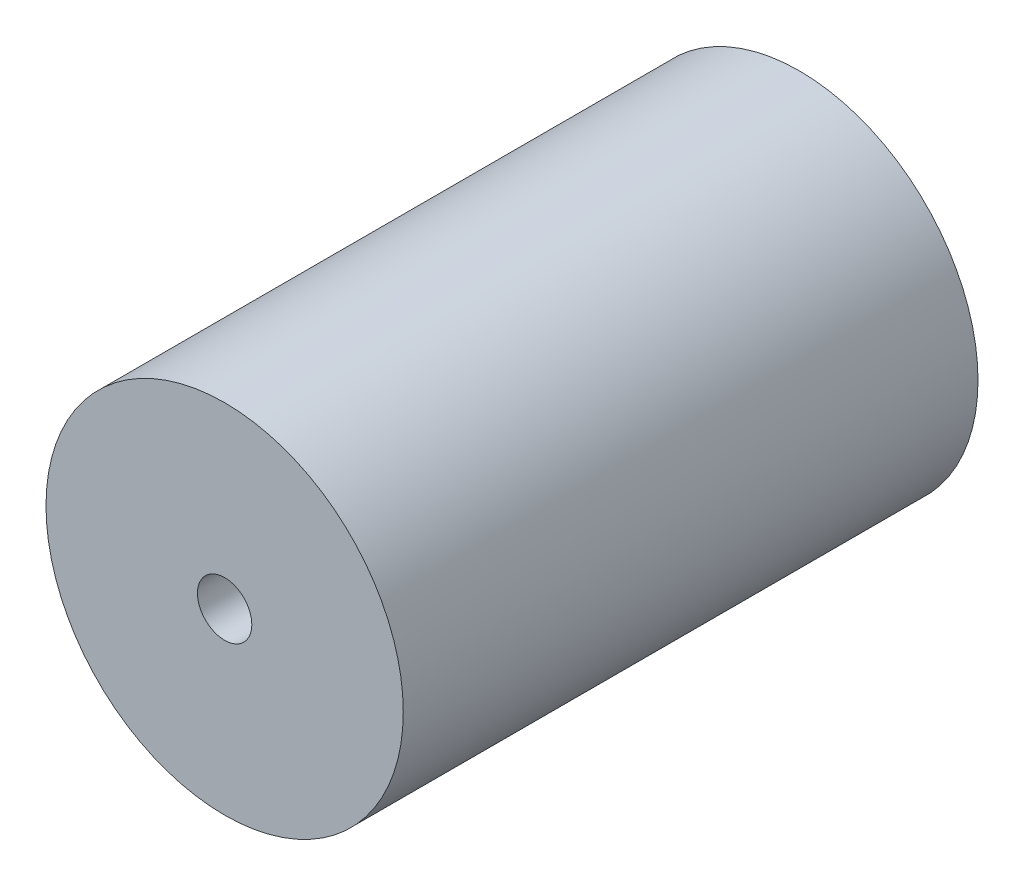
from build123d import *

# Parameters (mm, degrees)
SKETCH1_R           = 11.5
BOSS_EXTRUDE1_DEPTH = 37
SKETCH2_R           = 1.75
CUT_EXTRUDE1_DEPTH  = 41.416580756


with BuildPart() as part:
    # Sketch1 → Boss-Extrude1 (new body)
    with BuildSketch(Plane.XY):
        Circle(SKETCH1_R)
    extrude(amount=BOSS_EXTRUDE1_DEPTH)

    # Sketch2 → Cut-Extrude1 (cut, through all)
    with BuildSketch(Plane.XY.offset(37)):
        Circle(SKETCH2_R)
    extrude(amount=-CUT_EXTRUDE1_DEPTH, mode=Mode.SUBTRACT)


solid = part.part
